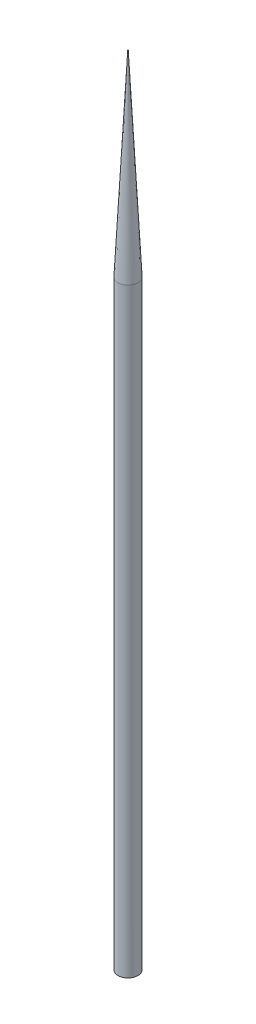
from build123d import *

# Parameters (mm, degrees)
SKETCH_1_R    = 0.5
SCALE_1_SCALE = 0.7


with BuildPart() as part:
    # По траектории1: sweep along a path in Эскиз2
    with BuildLine(Plane.XY) as sweep_1_path:
        Line((0, -20.788855077), (0, 9.211144923))
    # Эскиз1 → По траектории1 (sweep)
    with BuildSketch(Plane(origin=(0, 0, 0), x_dir=(1, 0, 0), z_dir=(0, 1, 0))):
        Circle(SKETCH_1_R)
    sweep(path=sweep_1_path.line)

    # Эскиз5 → Повернуть1 (revolve)
    with BuildSketch(Plane(origin=(0, 0, 0), x_dir=(0, 0, -1), z_dir=(1, 0, 0)), mode=Mode.PRIVATE) as revolve_1_sk:
        Polygon((0, 19.211144923), (0.5, 9.211144923), (0, 9.211144923), align=None)
    revolve(revolve_1_sk.sketch.rotate(Axis((0, 9.211144923, 0), (0, 1, 0)), 180), axis=Axis((0, 9.211144923, 0), (0, 1, 0)))


with BuildPart() as part_1:
    # Масштаб1: scaled about (0, -4.038855077, 0)
    add(part.part.scale(SCALE_1_SCALE).moved(Location((0, -1.211656523, 0))))


solid = part_1.part
